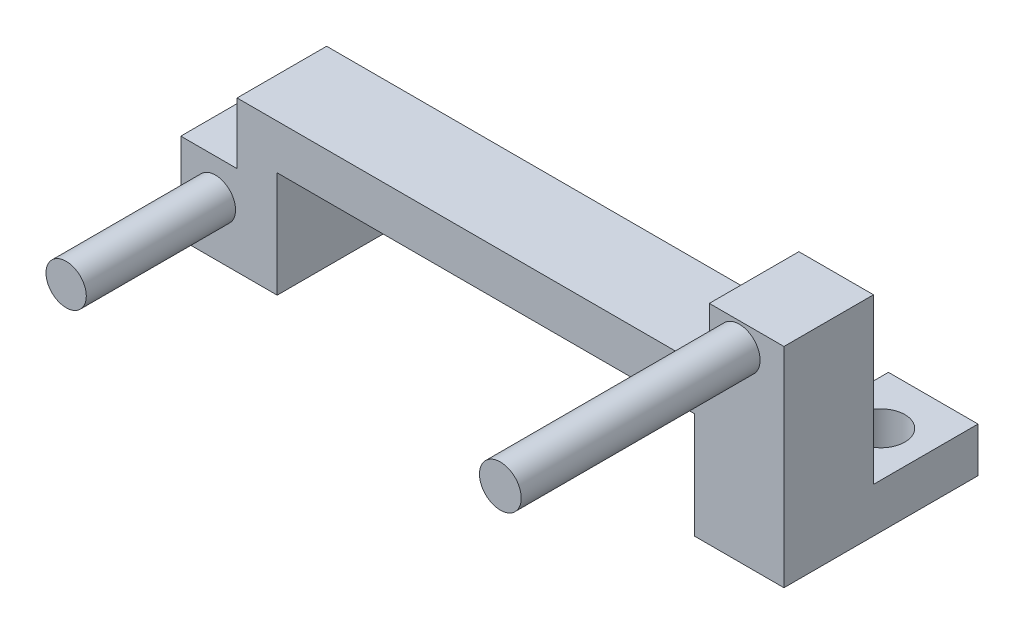
from build123d import *

# Parameters (mm, degrees)
SKETCH1_W            = 4
SKETCH1_H            = 14
BOSS_EXTRUDE1_DEPTH  = 3
SKETCH2_R            = 1.4
BOSS_EXTRUDE2_DEPTH  = 16
SKETCH3_W            = 4
SKETCH3_H            = 1
BOSS_EXTRUDE4_DEPTH  = 6
SKETCH7_W            = 3
SKETCH7_H            = 2
BOSS_EXTRUDE5_DEPTH  = 30.95
SKETCH8_W            = 3
SKETCH8_H            = 2
BOSS_EXTRUDE6_DEPTH  = 1
SKETCH9_W            = 1
SKETCH9_H            = 2
BOSS_EXTRUDE7_DEPTH  = 3
SKETCH10_W           = 1
SKETCH10_H           = 2
BOSS_EXTRUDE8_DEPTH  = 5.92
SKETCH11_W           = 1
SKETCH11_H           = 2
BOSS_EXTRUDE9_DEPTH  = 4
SKETCH12_W           = 1
SKETCH12_H           = 3
BOSS_EXTRUDE14_DEPTH = 0.93
SKETCH13_W           = 3
SKETCH13_H           = 3
BOSS_EXTRUDE15_DEPTH = 7.1
SKETCH14_W           = 3.33402541
SKETCH14_H           = 13.860919233
CUT_EXTRUDE3_DEPTH   = 10
SKETCH15_W           = 6.20666024
SKETCH15_H           = 3.660501205
CUT_EXTRUDE4_DEPTH   = 10
SKETCH16_W           = 3
SKETCH16_H           = 9.1
BOSS_EXTRUDE16_DEPTH = 0.12
SKETCH18_W           = 3
SKETCH18_H           = 9.1
BOSS_EXTRUDE18_DEPTH = 0.41
SKETCH19_W           = 3
SKETCH19_H           = 9.1
BOSS_EXTRUDE19_DEPTH = 0.89
SKETCH20_W           = 3
SKETCH20_H           = 6
BOSS_EXTRUDE20_DEPTH = 3.77
SKETCH21_R           = 1.35
BOSS_EXTRUDE23_DEPTH = 10
BOSS_EXTRUDE24_DEPTH = 3
SKETCH24_W           = 4
SKETCH24_H           = 1
BOSS_EXTRUDE25_DEPTH = 4
SKETCH25_W           = 4
SKETCH25_H           = 7
BOSS_EXTRUDE26_DEPTH = 2
SKETCH26_W           = 6.458993184
SKETCH26_H           = 3
BOSS_EXTRUDE27_DEPTH = 7
SKETCH27_R           = 1.6
CUT_EXTRUDE5_DEPTH   = 7
SKETCH28_R           = 1.6
CUT_EXTRUDE6_DEPTH   = 7
SKETCH31_W           = 7
SKETCH31_H           = 3
BOSS_EXTRUDE30_DEPTH = 1
SKETCH32_W           = 6
SKETCH32_H           = 7.1
BOSS_EXTRUDE31_DEPTH = 1
SKETCH33_W           = 31.638993184
SKETCH33_H           = 6
BOSS_EXTRUDE32_DEPTH = 1
BOSS_EXTRUDE33_DEPTH = 1


with BuildPart() as part:
    # Sketch1 → Boss-Extrude1 (new body)
    with BuildSketch(Plane.XY):
        with Locations((-1.434146341, -3.597560976)):
            Rectangle(SKETCH1_W, SKETCH1_H)
    extrude(amount=BOSS_EXTRUDE1_DEPTH)

    # Sketch2 → Boss-Extrude2 (add)
    with BuildSketch(Plane(origin=(0, 0, 0), x_dir=(-1, 0, 0), z_dir=(0, 0, -1))):
        with Locations(Location((1.434146341, 1.802439024, 0), (0, 0, 180))):
            Circle(SKETCH2_R)
    extrude(amount=BOSS_EXTRUDE2_DEPTH)

    # Sketch3 → Boss-Extrude4 (add)
    with BuildSketch(Plane.XY.offset(3)):
        with Locations((-1.434146341, -10.097560976)):
            Rectangle(SKETCH3_W, SKETCH3_H)
    extrude(amount=BOSS_EXTRUDE4_DEPTH)

    # Sketch7 → Boss-Extrude5 (add)
    with BuildSketch(Plane.ZY.offset(3.434146341)):
        with Locations((1.5, -2.497560976)):
            Rectangle(SKETCH7_W, SKETCH7_H)
    extrude(amount=BOSS_EXTRUDE5_DEPTH)

    # Sketch8 → Boss-Extrude6 (add)
    with BuildSketch(Plane.ZY.offset(34.384146341)):
        with Locations((1.5, -2.497560976)):
            Rectangle(SKETCH8_W, SKETCH8_H)
    extrude(amount=BOSS_EXTRUDE6_DEPTH)

    # Sketch9 → Boss-Extrude7 (add)
    with BuildSketch(Plane(origin=(0, 0, 0), x_dir=(-1, 0, 0), z_dir=(0, 0, -1))):
        with Locations((34.884146341, -2.497560976)):
            Rectangle(SKETCH9_W, SKETCH9_H)
    extrude(amount=BOSS_EXTRUDE7_DEPTH)

    # Sketch10 → Boss-Extrude8 (add)
    with BuildSketch(Plane(origin=(0, 0, -3), x_dir=(-1, 0, 0), z_dir=(0, 0, -1))):
        with Locations((34.884146341, -2.497560976)):
            Rectangle(SKETCH10_W, SKETCH10_H)
    extrude(amount=BOSS_EXTRUDE8_DEPTH)

    # Sketch11 → Boss-Extrude9 (add)
    with BuildSketch(Plane(origin=(0, 0, -8.92), x_dir=(-1, 0, 0), z_dir=(0, 0, -1))):
        with Locations((34.884146341, -2.497560976)):
            Rectangle(SKETCH11_W, SKETCH11_H)
    extrude(amount=BOSS_EXTRUDE9_DEPTH)

    # Sketch12 → Boss-Extrude14 (add)
    with BuildSketch(Plane.XZ.offset(3.497560976)):
        with Locations((-34.884146341, -9.28)):
            Rectangle(SKETCH12_W, SKETCH12_H)
    extrude(amount=BOSS_EXTRUDE14_DEPTH)

    # Sketch13 → Boss-Extrude15 (add)
    with BuildSketch(Plane.XZ.offset(3.497560976)):
        with Locations((-33.884146341, 1.5)):
            Rectangle(SKETCH13_W, SKETCH13_H)
    extrude(amount=BOSS_EXTRUDE15_DEPTH)

    # Sketch14 → Cut-Extrude3 (cut)
    with BuildSketch(Plane.XY.offset(3)):
        with Locations((-35.32015223, -3.66710136)):
            Rectangle(SKETCH14_W, SKETCH14_H)
    extrude(amount=-CUT_EXTRUDE3_DEPTH, mode=Mode.SUBTRACT)


with BuildPart() as cut_extrude3_piece_1:
    # of the separate pieces the step leaves, piece 1, a body of its own (cut_extrude3_pieces)
    add(part.part.solids().sort_by_distance((-3.434146341, 3.402439024, 0))[0])

    # Sketch16 → Boss-Extrude16 (add)
    with BuildSketch(Plane.ZY.offset(33.653139525)):
        with Locations((1.5, -6.047560976)):
            Rectangle(SKETCH16_W, SKETCH16_H)
    extrude(amount=BOSS_EXTRUDE16_DEPTH)

    # Sketch18 → Boss-Extrude18 (add)
    with BuildSketch(Plane.ZY.offset(33.773139525)):
        with Locations((1.5, -6.047560976)):
            Rectangle(SKETCH18_W, SKETCH18_H)
    extrude(amount=BOSS_EXTRUDE18_DEPTH)

    # Sketch19 → Boss-Extrude19 (add)
    with BuildSketch(Plane.ZY.offset(34.183139525)):
        with Locations((1.5, -6.047560976)):
            Rectangle(SKETCH19_W, SKETCH19_H)
    extrude(amount=BOSS_EXTRUDE19_DEPTH)

    # Sketch20 → Boss-Extrude20 (add)
    with BuildSketch(Plane.ZY.offset(35.073139525)):
        with Locations((1.5, -7.597560976)):
            Rectangle(SKETCH20_W, SKETCH20_H)
    extrude(amount=BOSS_EXTRUDE20_DEPTH)

    # Sketch21 → Boss-Extrude23 (add)
    with BuildSketch(Plane(origin=(0, 0, 0), x_dir=(-1, 0, 0), z_dir=(0, 0, -1))):
        with Locations(Location((36.523139525, -7.047560976, 0), (0, 0, 180))):
            Circle(SKETCH21_R)
    extrude(amount=BOSS_EXTRUDE23_DEPTH)

    # Sketch23 → Boss-Extrude24 (add)
    with BuildSketch(Plane.XY.offset(3)):
        Polygon((-38.843139525, -10.597560976), (-38.843139525, -4.597560976), (-35.073139525, -4.597560976), (-35.073139525, -1.497560976), (-3.434146341, -1.497560976), (-3.434146341, 3.402439024), (0.565853659, 3.402439024), (0.565853659, -9.597560976), (-3.434146341, -9.597560976), (-3.434146341, -3.497560976), (-32.384146341, -3.497560976), (-32.384146341, -10.597560976), align=None)
    extrude(amount=BOSS_EXTRUDE24_DEPTH)

    # Sketch24 → Boss-Extrude25 (add)
    with BuildSketch(Plane.XY.offset(9)):
        with Locations((-1.434146341, -10.097560976)):
            Rectangle(SKETCH24_W, SKETCH24_H)
    extrude(amount=BOSS_EXTRUDE25_DEPTH)

    # Sketch25 → Boss-Extrude26 (add)
    with BuildSketch(Plane(origin=(0, -9.597560976, 0), x_dir=(1, 0, 0), z_dir=(0, 1, 0))):
        with Locations((-1.434146341, -9.5)):
            Rectangle(SKETCH25_W, SKETCH25_H)
    extrude(amount=BOSS_EXTRUDE26_DEPTH)

    # Sketch26 → Boss-Extrude27 (add)
    with BuildSketch(Plane.XY.offset(6)):
        with Locations((-35.613642933, -9.097560976)):
            Rectangle(SKETCH26_W, SKETCH26_H)
    extrude(amount=BOSS_EXTRUDE27_DEPTH)

    # Sketch27 → Cut-Extrude5 (cut)
    with BuildSketch(Plane(origin=(0, -7.597560976, 0), x_dir=(1, 0, 0), z_dir=(0, 1, 0))):
        with Locations(Location((-35.613642933, -9.5, 0), (0, 0, 270))):
            Circle(SKETCH27_R)
    extrude(amount=-CUT_EXTRUDE5_DEPTH, mode=Mode.SUBTRACT)

    # Sketch28 → Cut-Extrude6 (cut)
    with BuildSketch(Plane(origin=(0, -7.597560976, 0), x_dir=(1, 0, 0), z_dir=(0, 1, 0))):
        with Locations(Location((-1.434146341, -9.5, 0), (0, 0, 270))):
            Circle(SKETCH28_R)
    extrude(amount=-CUT_EXTRUDE6_DEPTH, mode=Mode.SUBTRACT)

    # Sketch31 → Boss-Extrude30 (add)
    with BuildSketch(Plane.ZY.offset(3.434146341)):
        with Locations((9.5, -9.097560976)):
            Rectangle(SKETCH31_W, SKETCH31_H)
    extrude(amount=BOSS_EXTRUDE30_DEPTH)

    # Sketch32 → Boss-Extrude31 (add)
    with BuildSketch(Plane.ZY.offset(3.434146341)):
        with Locations((3, -7.047560976)):
            Rectangle(SKETCH32_W, SKETCH32_H)
    extrude(amount=BOSS_EXTRUDE31_DEPTH)

    # Sketch33 → Boss-Extrude32 (add)
    with BuildSketch(Plane(origin=(0, -1.497560976, 0), x_dir=(1, 0, 0), z_dir=(0, 1, 0))):
        with Locations((-19.253642933, -3)):
            Rectangle(SKETCH33_W, SKETCH33_H)
    extrude(amount=BOSS_EXTRUDE32_DEPTH)


with BuildPart() as cut_extrude3_piece_2:
    # of the separate pieces the step leaves, piece 2, a body of its own (cut_extrude3_pieces)
    add(part.part.solids().sort_by_distance((-34.384146341, -1.497560976, -7))[0])

    # Sketch15 → Cut-Extrude4 (cut)
    with BuildSketch(Plane.ZY.offset(35.384146341)):
        with Locations((-9.81666988, -3.327811578)):
            Rectangle(SKETCH15_W, SKETCH15_H)
    extrude(amount=-CUT_EXTRUDE4_DEPTH, mode=Mode.SUBTRACT)


with BuildPart() as body_2:
    # Mirror1: mirrored copy
    add(cut_extrude3_piece_1.part.mirror(Plane.XY.offset(13)))

    # Sketch34 → Boss-Extrude33 (add)
    with BuildSketch(Plane(origin=(0.565853659, 0, 0), x_dir=(0, 0, -1), z_dir=(1, 0, 0))):
        Polygon((-26, 3.402439024), (-20, 3.402439024), (-20, -7.597560976), (-13, -7.597560976), (-13, -10.597560976), (-26, -10.597560976), align=None)
    extrude(amount=BOSS_EXTRUDE33_DEPTH)


solid = body_2.part
